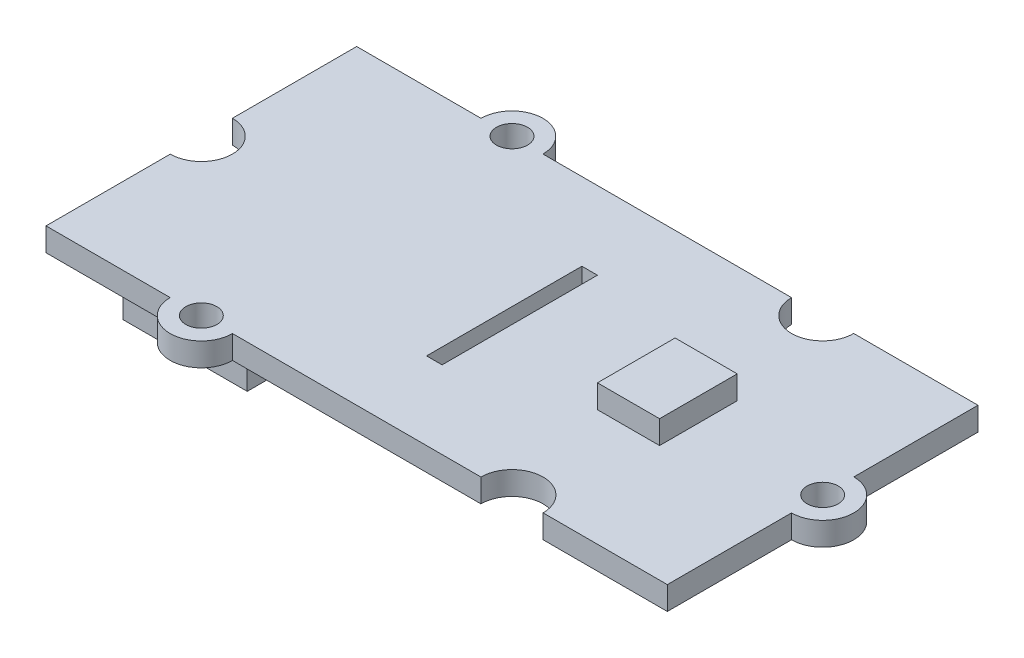
from build123d import *

# Parameters (mm, degrees)
ESQUISSE1_R           = 1
ESQUISSE1_W           = 1
ESQUISSE1_H           = 10
BASE_DEPTH            = 1.5
ESQUISSE2_W           = 4
ESQUISSE2_H           = 5
SOIC_8_DEPTH          = 1.5
ESQUISSE3_W           = 8
ESQUISSE3_H           = 12
GROVE_CONNECTOR_DEPTH = 5.25


with BuildPart() as part:
    # Esquisse1 → Base (new body)
    with BuildSketch(Plane(origin=(0, 0, 0), x_dir=(1, 0, 0), z_dir=(0, 1, 0))):
        with BuildLine():
            Line((-20, -2), (-20, -10))
            Line((-20, -10), (-12.006445979, -10))
            ThreePointArc((-12.006445979, -10), (-10, -12.006445979), (-7.993554021, -10))
            Line((-7.993554021, -10), (8, -10))
            ThreePointArc((8, -10), (10, -8), (12, -10))
            Line((12, -10), (20, -10))
            Line((20, -10), (20, -2.006445979))
            ThreePointArc((20, -2.006445979), (22.006445979, 0), (20, 2.006445979))
            Line((20, 2.006445979), (20, 10))
            Line((20, 10), (12, 10))
            ThreePointArc((12, 10), (10, 8), (8, 10))
            Line((8, 10), (-8.006445979, 10))
            ThreePointArc((-8.006445979, 10), (-10, 11.993554021), (-11.993554021, 10))
            Line((-11.993554021, 10), (-20, 10))
            Line((-20, 10), (-20, 2))
            ThreePointArc((-20, 2), (-18, 0), (-20, -2))
        make_face()
        with Locations(Location((20, 0, 0), (0, 0, 270))):
            Circle(ESQUISSE1_R, mode=Mode.SUBTRACT)
        with Locations(Location((-10, 10, 0), (0, 0, 270))):
            Circle(ESQUISSE1_R, mode=Mode.SUBTRACT)
        with Locations(Location((-10, -10, 0), (0, 0, 270))):
            Circle(ESQUISSE1_R, mode=Mode.SUBTRACT)
        Rectangle(ESQUISSE1_W, ESQUISSE1_H, mode=Mode.SUBTRACT)
    extrude(amount=BASE_DEPTH)

    # Esquisse2 → SOIC-8 (add)
    with BuildSketch(Plane(origin=(0, 1.5, 0), x_dir=(1, 0, 0), z_dir=(0, 1, 0))):
        with Locations((10, 0)):
            Rectangle(ESQUISSE2_W, ESQUISSE2_H)
    extrude(amount=SOIC_8_DEPTH)

    # Esquisse3 → Grove connector (add)
    with BuildSketch(Plane(origin=(0, 0, 0), x_dir=(1, 0, 0), z_dir=(0, 1, 0))):
        with Locations((-15.044217332, 0)):
            Rectangle(ESQUISSE3_W, ESQUISSE3_H)
    extrude(amount=-GROVE_CONNECTOR_DEPTH)


solid = part.part
